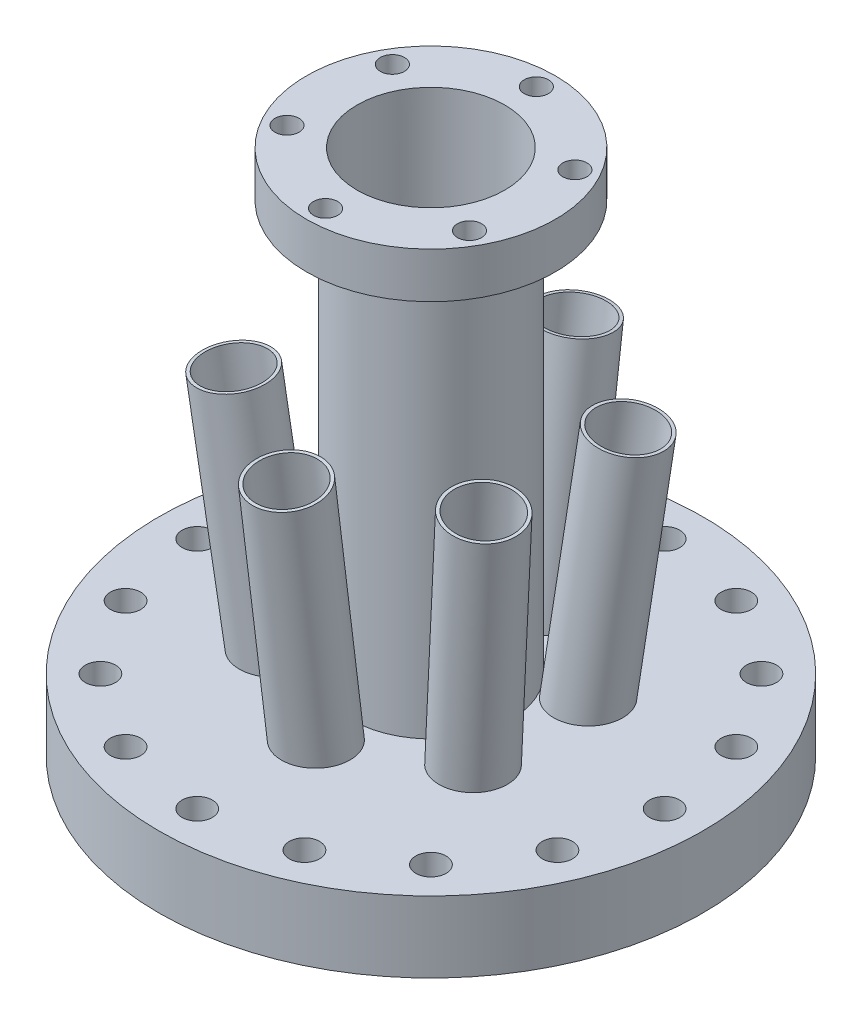
from build123d import *

# Parameters (mm, degrees)
SKETCH1_R         = 75.819
EXTRUDE1_DEPTH    = 19.812
SKETCH2_R         = 4.2164
EXTRUDE2_DEPTH    = 19.812
CIRPATTERN1_COUNT = 16
SKETCH3_R         = 22.225
SKETCH3_R_2       = 20.574
EXTRUDE3_DEPTH    = 127
EXTRUDE4_REACH    = 168.211
SKETCH4_R         = 20.574
SKETCH6_R         = 34.671
SKETCH6_R_2       = 20.574
EXTRUDE5_DEPTH    = 12.7
EXTRUDE6_REACH    = 183.799
SKETCH7_R         = 3.3655
CIRPATTERN2_COUNT = 6
SKETCH10_R        = 9.525
SKETCH10_R_2      = 8.636
EXTRUDE7_DEPTH    = 330.2
EXTRUDE8_REACH    = 404.651
SKETCH10_2_R      = 9.525
SKETCH10_2_R_2    = 8.636
SKETCH11_R        = 8.636
EXTRUDE9_DEPTH    = 403.65117179
CIRPATTERN3_COUNT = 6


with BuildPart() as part:
    # Sketch1 → Extrude1 (new body)
    with BuildSketch(Plane(origin=(0, 0, 0), x_dir=(1, 0, 0), z_dir=(0, 1, 0))):
        with Locations(Location((0, 0, 0), (0, 0, 270))):
            Circle(SKETCH1_R)
    extrude(amount=EXTRUDE1_DEPTH)

    # Sketch2 → Extrude2 (cut)
    with BuildSketch(Plane(origin=(0, 19.812, 0), x_dir=(1, 0, 0), z_dir=(0, 1, 0))):
        with Locations(Location((0, 65.1256, 0), (0, 0, 270))):
            Circle(SKETCH2_R)
    extrude2 = extrude(amount=-EXTRUDE2_DEPTH, mode=Mode.SUBTRACT)

    # CirPattern1: Extrude2 ×16 about axis
    cirpattern1_axis = Axis((0, 0, 0), (0, 1, 0))
    for i in range(1, CIRPATTERN1_COUNT):
        add(extrude2.rotate(cirpattern1_axis, i * 360 / CIRPATTERN1_COUNT), mode=Mode.SUBTRACT)

    # Sketch3 → Extrude3 (add)
    with BuildSketch(Plane(origin=(0, 19.812, 0), x_dir=(1, 0, 0), z_dir=(0, 1, 0))):
        with Locations(Location((0, 0, 0), (0, 0, 270))):
            Circle(SKETCH3_R)
        with Locations(Location((0, 0, 0), (0, 0, 270))):
            Circle(SKETCH3_R_2, mode=Mode.SUBTRACT)
    extrude(amount=EXTRUDE3_DEPTH)

    # Sketch4 → Extrude4 (cut, up to next)
    with BuildSketch(Plane(origin=(0, 19.812, 0), x_dir=(1, 0, 0), z_dir=(0, 1, 0)), mode=Mode.PRIVATE) as extrude4_sk1:
        with Locations(Location((0, 0, 0), (0, 0, 270))):
            Circle(SKETCH4_R)
    extrude4_tool1 = extrude(extrude4_sk1.sketch, amount=-EXTRUDE4_REACH, mode=Mode.PRIVATE) & part.part
    add(extrude4_tool1.solids().sort_by_distance((0, 19.812, 0))[0], mode=Mode.SUBTRACT)

    # Sketch6 → Extrude5 (add)
    with BuildSketch(Plane(origin=(0, 146.812, 0), x_dir=(1, 0, 0), z_dir=(0, 1, 0))):
        with Locations(Location((0, 0, 0), (0, 0, 270))):
            Circle(SKETCH6_R)
        with Locations(Location((0, 0, 0), (0, 0, 270))):
            Circle(SKETCH6_R_2, mode=Mode.SUBTRACT)
    extrude(amount=-EXTRUDE5_DEPTH)

    # Sketch7 → Extrude6 (cut, up to next)
    with BuildSketch(Plane(origin=(0, 146.812, 0), x_dir=(1, 0, 0), z_dir=(0, 1, 0)), mode=Mode.PRIVATE) as extrude6_sk1:
        with Locations(Location((0, 29.3624, 0), (0, 0, 270))):
            Circle(SKETCH7_R)
    extrude6_tool1 = extrude(extrude6_sk1.sketch, amount=-EXTRUDE6_REACH, mode=Mode.PRIVATE) & part.part
    extrude6 = extrude6_tool1.solids().sort_by_distance((0, 146.812, -29.3624))[0]
    add(extrude6, mode=Mode.SUBTRACT)

    # CirPattern2: Extrude6 ×6 about axis
    cirpattern2_axis = Axis((0, 0, 0), (0, 1, 0))
    for i in range(1, CIRPATTERN2_COUNT):
        add(extrude6.rotate(cirpattern2_axis, i * 360 / CIRPATTERN2_COUNT), mode=Mode.SUBTRACT)

    # Sketch10 → Extrude7 (add)
    with BuildSketch(Plane(origin=(0, -241.3, 0), x_dir=(-1, 0, 0), z_dir=(0, 0.992546151641322, 0.12186934340514811))):
        with Locations(Location((0, 0, 0), (0, 0, 253.960195481))):
            Circle(SKETCH10_R)
        with Locations(Location((0, 0, 0), (0, 0, 270))):
            Circle(SKETCH10_R_2, mode=Mode.SUBTRACT)
    extrude7 = extrude(amount=EXTRUDE7_DEPTH)

    # Extrude8: up to this face of the body (flat: up to its plane)
    extrude8_end = Plane(part.part.faces().sort_by_distance((0, 0, -73.674514838))[0])
    # Sketch10<2> → Extrude8 (cut, up to the picked face)
    with BuildSketch(Plane(origin=(0, -241.3, 0), x_dir=(-1, 0, 0), z_dir=(0, 0.992546151641322, 0.12186934340514811)), mode=Mode.PRIVATE) as extrude8_sk1:
        with Locations(Location((0, 0, 0), (0, 0, 270))):
            Circle(SKETCH10_2_R)
        with Locations(Location((0, 0, 0), (0, 0, 270))):
            Circle(SKETCH10_2_R_2, mode=Mode.SUBTRACT)
    extrude8_tool1 = split(extrude(extrude8_sk1.sketch, amount=EXTRUDE8_REACH, mode=Mode.PRIVATE), bisect_by=extrude8_end, keep=Keep.BOTH, mode=Mode.PRIVATE)
    extrude8 = extrude8_tool1.solids().sort_by(Axis((0, -242.427973, 9.186603), (0, 0.992546151641322, 0.12186934340514811)))[0]
    add(extrude8, mode=Mode.SUBTRACT)

    # Sketch11 → Extrude9 (cut, through all)
    with BuildSketch(Plane(origin=(0, -241.3, 0), x_dir=(-1, 0, 0), z_dir=(0, 0.992546151641322, 0.12186934340514811))):
        with Locations(Location((0, 0, 0), (0, 0, 270))):
            Circle(SKETCH11_R)
    extrude9 = extrude(amount=EXTRUDE9_DEPTH, mode=Mode.SUBTRACT)

    # CirPattern3: Extrude7, Extrude8, Extrude9 ×6 about axis
    cirpattern3_axis = Axis((0, 0, 0), (0, 1, 0))
    add([extrude7.rotate(cirpattern3_axis, i * 360 / CIRPATTERN3_COUNT) for i in range(1, CIRPATTERN3_COUNT)])
    add([extrude8.rotate(cirpattern3_axis, i * 360 / CIRPATTERN3_COUNT) for i in range(1, CIRPATTERN3_COUNT)], mode=Mode.SUBTRACT)
    add([extrude9.rotate(cirpattern3_axis, i * 360 / CIRPATTERN3_COUNT) for i in range(1, CIRPATTERN3_COUNT)], mode=Mode.SUBTRACT)


solid = part.part
